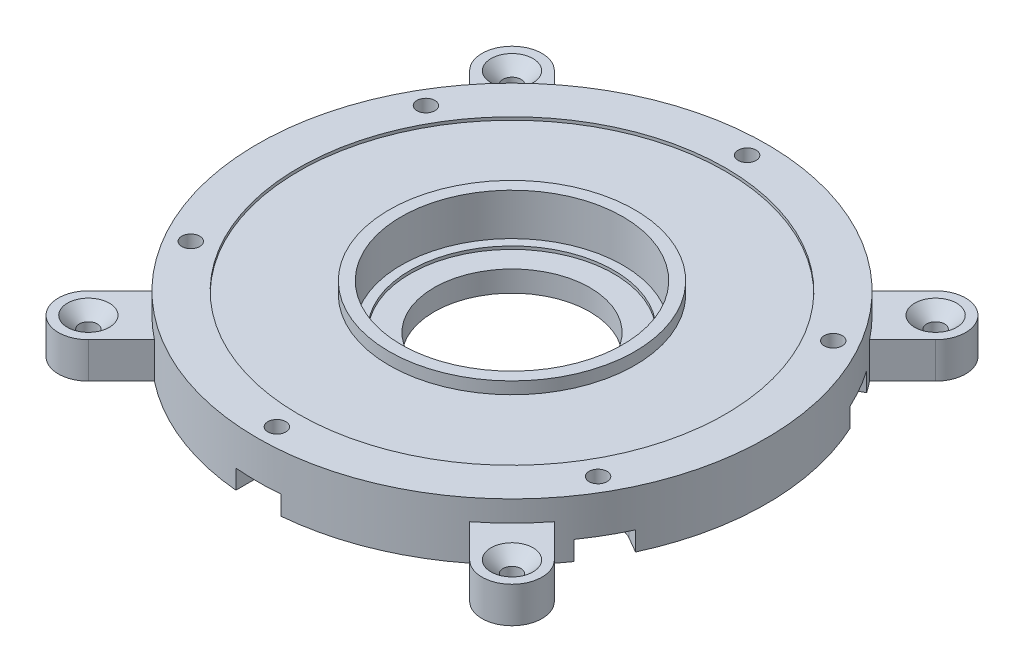
from build123d import *

# Parameters (mm, degrees)
ESBO_O1_R                = 42.5
RESSALTO_EXTRUS_O1_DEPTH = 9
RESSALTO_EXTRUS_O2_START = 2
ESBO_O3_R                = 20.5
ESBO_O3_R_2              = 18.5
RESSALTO_EXTRUS_O2_DEPTH = 2
CORTE_EXTRUS_O1_DEPTH    = 3.2
ESBO_O9_R                = 42.5
ESBO_O9_R_2              = 35.625
RESSALTO_EXTRUS_O4_DEPTH = 0.5
ESBO_O5_R                = 1.5
CORTE_EXTRUS_O2_DEPTH    = 10
PADR_OCIRCULAR1_COUNT    = 6
RESSALTO_EXTRUS_O3_DEPTH = 6
ESBO_O8_R                = 1.5
CORTE_EXTRUS_O3_DEPTH    = 10
PADR_OCIRCULAR2_COUNT    = 4
CHANFRO1_SIZE            = 2


with BuildPart() as part:
    # Esboço1 → Ressalto-extrusão1 (new body)
    with BuildSketch(Plane(origin=(0, 0, 0), x_dir=(1, 0, 0), z_dir=(0, 1, 0))):
        with Locations(Location((0, 0, 0), (0, 0, 270))):
            Circle(ESBO_O1_R)
    extrude(amount=RESSALTO_EXTRUS_O1_DEPTH)

    # Esboço2 → Corte-Revolução1 (revolve, cut)
    with BuildSketch(Plane(origin=(0, 0, 0), x_dir=(0, 0, -1), z_dir=(1, 0, 0))):
        Polygon((0, 0), (-13, 0), (-13, 3.5), (-17, 3.5), (-17, 4), (-18.5, 4), (-18.5, 9), (0, 9), align=None)
    revolve(axis=Axis((0, 9, 0), (0, -1, 0)), mode=Mode.SUBTRACT)

    # Esboço3 → Ressalto-extrusão2 (add)
    with BuildSketch(Plane(origin=(0, 9, 0), x_dir=(1, 0, 0), z_dir=(0, 1, 0)).offset(RESSALTO_EXTRUS_O2_START)):
        with Locations(Location((0, 0, 0), (0, 0, 270))):
            Circle(ESBO_O3_R)
        with Locations(Location((0, 0, 0), (0, 0, 270))):
            Circle(ESBO_O3_R_2, mode=Mode.SUBTRACT)
    extrude(amount=-RESSALTO_EXTRUS_O2_DEPTH)

    # Esboço4 → Corte-extrusão1 (cut)
    with BuildSketch(Plane.XZ):
        with BuildLine():
            Line((-3.75, 39.25), (-3.75, 42.334235555))
            ThreePointArc((-3.75, 42.334235555), (0, 42.5), (3.75, 42.334235555))
            Line((3.75, 42.334235555), (3.75, 39.25))
            ThreePointArc((3.75, 39.25), (0, 35.5), (-3.75, 39.25))
        make_face()
    corte_extrus_o1 = extrude(amount=-CORTE_EXTRUS_O1_DEPTH, mode=Mode.SUBTRACT)

    # Esboço9 → Ressalto-extrusão4 (add)
    with BuildSketch(Plane(origin=(0, 9, 0), x_dir=(1, 0, 0), z_dir=(0, 1, 0))):
        with Locations(Location((0, 0, 0), (0, 0, 275.062092964))):
            Circle(ESBO_O9_R)
        with Locations(Location((0, 0, 0), (0, 0, 270))):
            Circle(ESBO_O9_R_2, mode=Mode.SUBTRACT)
    extrude(amount=RESSALTO_EXTRUS_O4_DEPTH)

    # Esboço5 → Corte-extrusão2 (cut)
    with BuildSketch(Plane.XZ.offset(-3.2)):
        with Locations(Location((0, 39.25, 0), (0, 0, 270))):
            Circle(ESBO_O5_R)
    corte_extrus_o2 = extrude(amount=-CORTE_EXTRUS_O2_DEPTH, mode=Mode.SUBTRACT)

    # PadrãoCircular1: Corte-extrusão1, Corte-extrusão2 ×6 about axis
    padr_ocircular1_axis = Axis((0, 0, 0), (0, 1, 0))
    add([corte_extrus_o1.rotate(padr_ocircular1_axis, i * 360 / PADR_OCIRCULAR1_COUNT) for i in range(1, PADR_OCIRCULAR1_COUNT)], mode=Mode.SUBTRACT)
    add([corte_extrus_o2.rotate(padr_ocircular1_axis, i * 360 / PADR_OCIRCULAR1_COUNT) for i in range(1, PADR_OCIRCULAR1_COUNT)], mode=Mode.SUBTRACT)

    # Esboço6 → Ressalto-extrusão3 (add)
    with BuildSketch(Plane.XZ):
        with BuildLine():
            ThreePointArc((38.890872965, 31.819805153), (38.890872965, 38.890872965), (31.819805153, 38.890872965))
            Line((31.819805153, 38.890872965), (26.30780706, 33.378874872))
            ThreePointArc((26.30780706, 33.378874872), (30.0520382, 30.0520382), (33.378874872, 26.30780706))
            Line((33.378874872, 26.30780706), (38.890872965, 31.819805153))
        make_face()
    ressalto_extrus_o3 = extrude(amount=-RESSALTO_EXTRUS_O3_DEPTH)

    # Esboço8 → Corte-extrusão3 (cut)
    with BuildSketch(Plane.XZ):
        with Locations(Location((35.355339059, 35.355339059, 0), (0, 0, 270))):
            Circle(ESBO_O8_R)
    corte_extrus_o3 = extrude(amount=-CORTE_EXTRUS_O3_DEPTH, mode=Mode.SUBTRACT)

    # PadrãoCircular2: Ressalto-extrusão3, Corte-extrusão3 ×4 about axis
    padr_ocircular2_axis = Axis((0, 0, 0), (0, 1, 0))
    add([ressalto_extrus_o3.rotate(padr_ocircular2_axis, i * 360 / PADR_OCIRCULAR2_COUNT) for i in range(1, PADR_OCIRCULAR2_COUNT)])
    add([corte_extrus_o3.rotate(padr_ocircular2_axis, i * 360 / PADR_OCIRCULAR2_COUNT) for i in range(1, PADR_OCIRCULAR2_COUNT)], mode=Mode.SUBTRACT)

    # Chanfro1
    chanfro1_edges = [part.edges().sort_by_distance(p)[0] for p in [
        (35.355339059, 6, 36.855339059),
        (-36.855339059, 6, 35.355339059),
        (-35.355339059, 6, -36.855339059),
        (36.855339059, 6, -35.355339059),
    ]]
    chamfer(chanfro1_edges, length=CHANFRO1_SIZE)


solid = part.part
